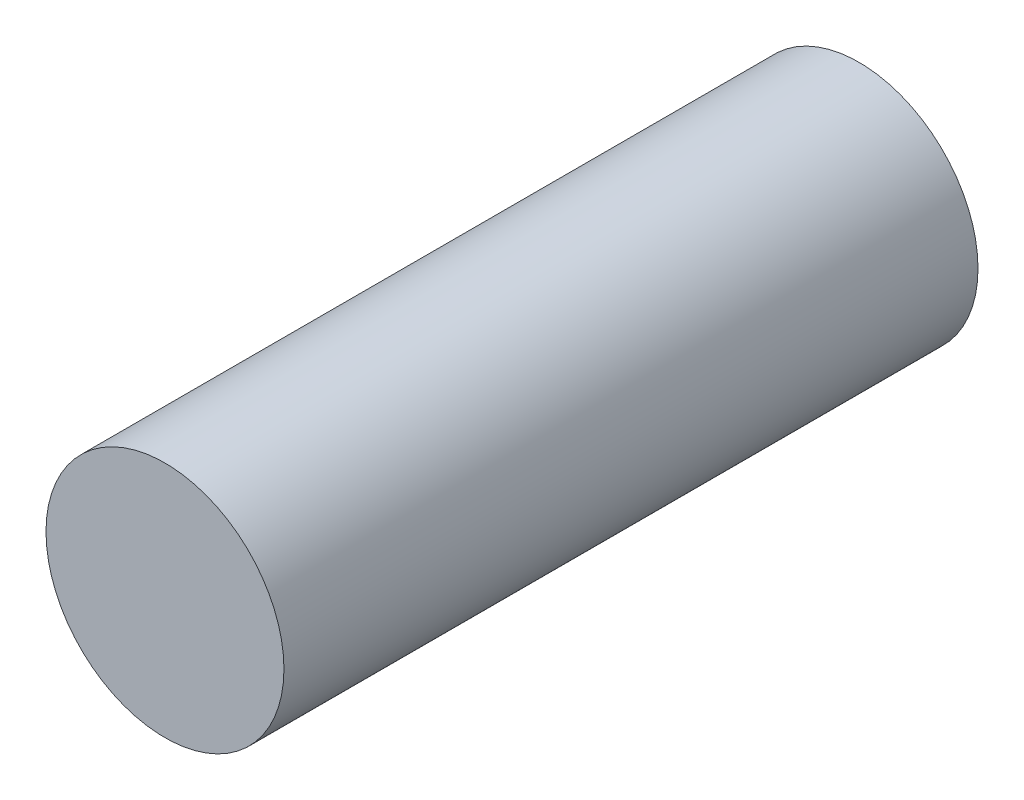
from build123d import *

# Parameters (mm, degrees)
SKETCH_1_R      = 1.8
EXTRUDE_1_DEPTH = 10.5


with BuildPart() as part:
    # Эскиз1 → Бобышка-Вытянуть1 (new body)
    with BuildSketch(Plane.XY):
        Circle(SKETCH_1_R)
    extrude(amount=EXTRUDE_1_DEPTH)


solid = part.part
